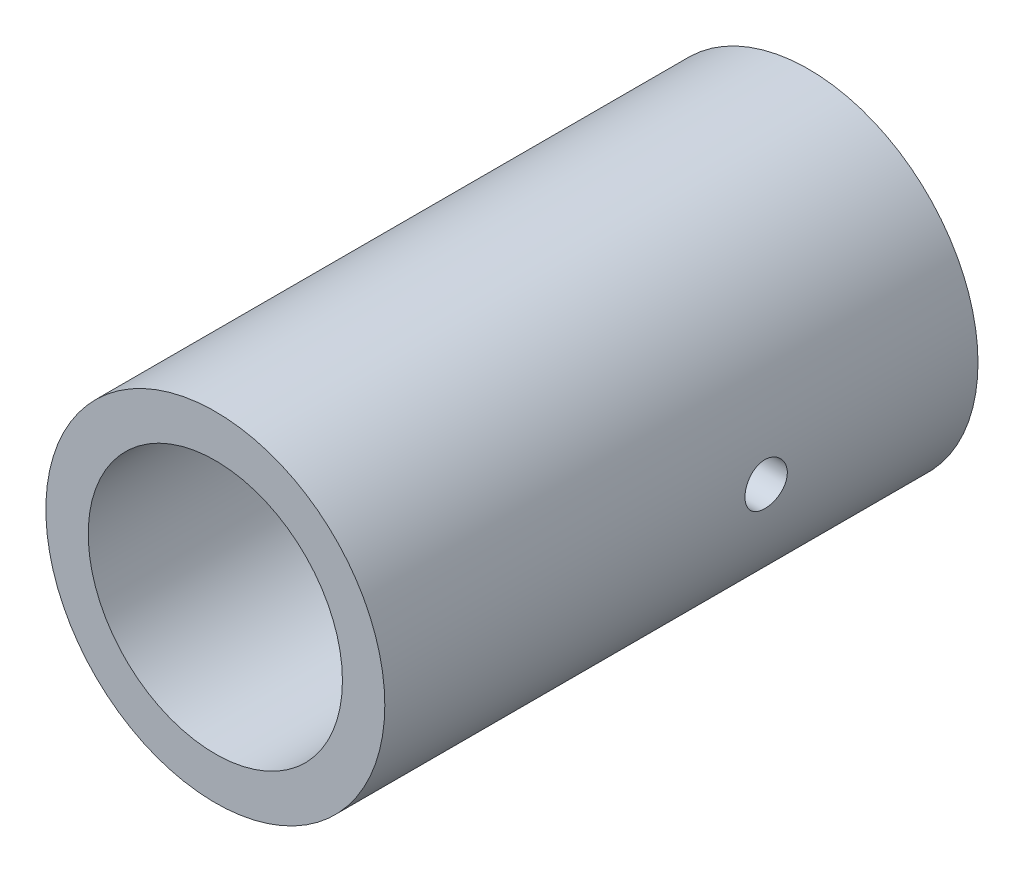
from build123d import *

# Parameters (mm, degrees)
SKETCH1_R           = 20
BOSS_EXTRUDE1_DEPTH = 70
SKETCH2_R           = 15
CUT_EXTRUDE1_DEPTH  = 70
SKETCH3_R           = 2.5
CUT_EXTRUDE2_DEPTH  = 53


with BuildPart() as part:
    # Sketch1 → Boss-Extrude1 (new body)
    with BuildSketch(Plane.XY):
        Circle(SKETCH1_R)
    extrude(amount=BOSS_EXTRUDE1_DEPTH)

    # Sketch2 → Cut-Extrude1 (cut)
    with BuildSketch(Plane.XY.offset(70)):
        Circle(SKETCH2_R)
    extrude(amount=-CUT_EXTRUDE1_DEPTH, mode=Mode.SUBTRACT)

    # Sketch3 → Cut-Extrude2 (cut)
    with BuildSketch(Plane(origin=(20, 0, 0), x_dir=(0, 0, -1), z_dir=(1, 0, 0))):
        with Locations((-25, 0)):
            Circle(SKETCH3_R)
    extrude(amount=-CUT_EXTRUDE2_DEPTH, mode=Mode.SUBTRACT)


solid = part.part
